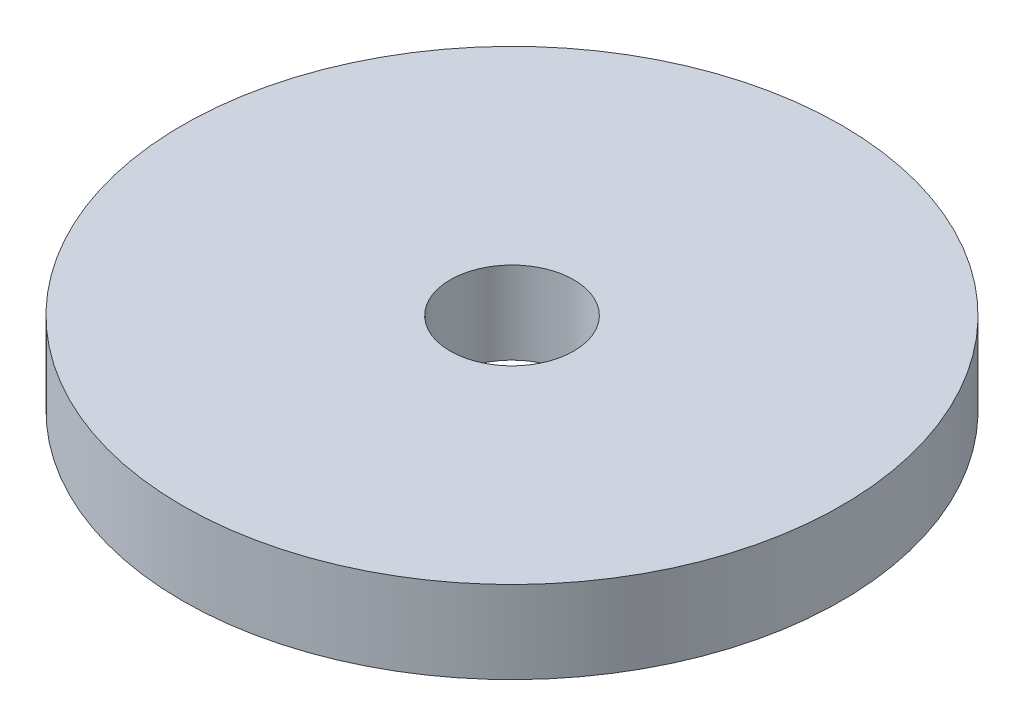
from build123d import *

# Parameters (mm, degrees)
SKETCH1_R           = 50.8
SKETCH1_R_2         = 9.525
BOSS_EXTRUDE1_DEPTH = 12.7


with BuildPart() as part:
    # Sketch1 → Boss-Extrude1 (new body)
    with BuildSketch(Plane(origin=(0, 0, 0), x_dir=(1, 0, 0), z_dir=(0, 1, 0))):
        with Locations(Location((0, 0, 0), (0, 0, 270))):
            Circle(SKETCH1_R)
        with Locations(Location((0, 0, 0), (0, 0, 270))):
            Circle(SKETCH1_R_2, mode=Mode.SUBTRACT)
    extrude(amount=BOSS_EXTRUDE1_DEPTH)


solid = part.part
